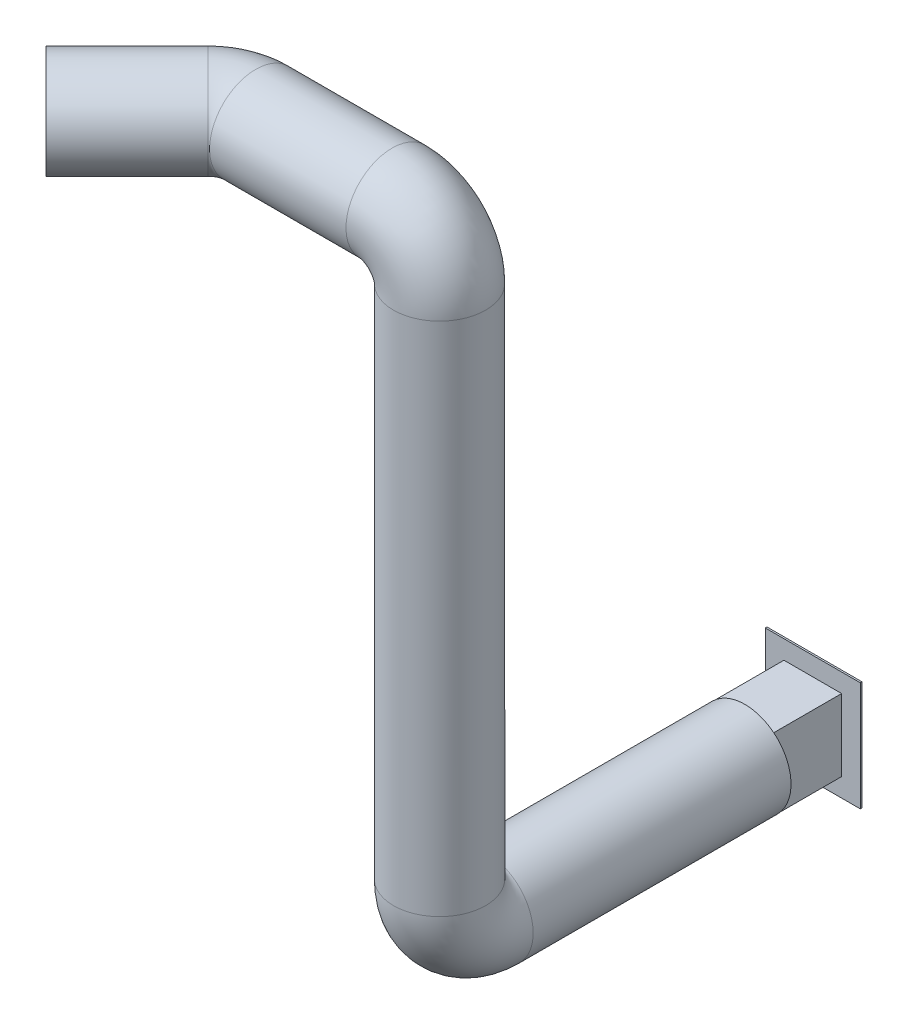
from build123d import *
from build123d.topology import SkipClean

# Parameters (mm, degrees)
CROQUIS1_W              = 140
CROQUIS1_H              = 161
CROQUIS1_W_2            = 80
CROQUIS1_H_2            = 101
SALIENTE_EXTRUIR1_DEPTH = 2.5
CROQUIS2_W              = 85
CROQUIS2_H              = 106
CROQUIS2_W_2            = 80
CROQUIS2_H_2            = 101
SALIENTE_EXTRUIR2_DEPTH = 100
CROQUIS3_R              = 67.935631299
SALIENTE_EXTRUIR3_DEPTH = 100
CROQUIS4_R              = 67.935631299


with BuildPart() as part:
    # Croquis1 → Saliente-Extruir1 (new body)
    with BuildSketch(Plane.XY):
        with Locations((70, -80.5)):
            Rectangle(CROQUIS1_W, CROQUIS1_H)
        with Locations((70, -80.5)):
            Rectangle(CROQUIS1_W_2, CROQUIS1_H_2, mode=Mode.SUBTRACT)
    extrude(amount=SALIENTE_EXTRUIR1_DEPTH)

    # Croquis2 → Saliente-Extruir2 (add)
    with BuildSketch(Plane.XY.offset(2.5)):
        with Locations((70, -80.5)):
            Rectangle(CROQUIS2_W, CROQUIS2_H)
        with Locations((70, -80.5)):
            Rectangle(CROQUIS2_W_2, CROQUIS2_H_2, mode=Mode.SUBTRACT)
    extrude(amount=SALIENTE_EXTRUIR2_DEPTH)

    # Croquis3 → Saliente-Extruir3 (add)
    with BuildSketch(Plane.XY.offset(102.5)):
        with Locations(Location((70, -80.5, 0), (0, 0, 128.725665443))):
            Circle(CROQUIS3_R)
    extrude(amount=SALIENTE_EXTRUIR3_DEPTH)

    # Barrer1: sweep along a curve in space
    with SkipClean():  # the faces are left unmerged after this step: merging them gives an invalid solid
        with BuildLine() as barrer1_path:
            Line((70, -80.5, 202.5), (70, -80.5, 482.5))
            ThreePointArc((70, -80.5, 482.5), (70, -59.997474683, 531.997474683), (70, -10.5, 552.5))
            Line((70, -10.5, 552.5), (70, 749.5, 552.5))
            ThreePointArc((70, 749.5, 552.5), (49.497474683, 798.997474683, 552.5), (0, 819.5, 552.5))
            Line((0, 819.5, 552.5), (-201.005050634, 819.5, 552.5))
            ThreePointArc((-201.005050634, 819.5, 552.5), (-227.792890899, 819.5, 557.828432724), (-250.502525317, 819.5, 573.002525317))
            Line((-370, 819.5, 692.5), (-250.502525317, 819.5, 573.002525317))
        # Croquis4 → Barrer1 (sweep)
        with BuildSketch(Plane.XY.offset(202.5)):
            with Locations((70, -80.5)):
                Circle(CROQUIS4_R)
        sweep(path=barrer1_path.line)


solid = part.part
